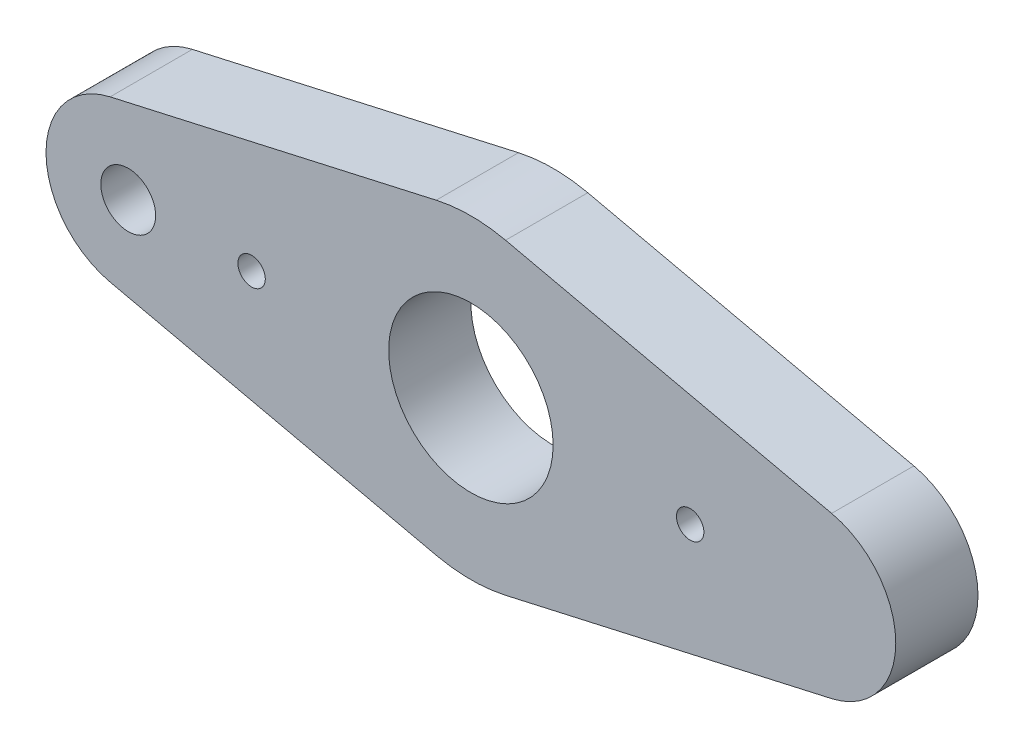
from build123d import *

# Parameters (mm, degrees)
CROQUIS1_R              = 2
CROQUIS1_R_2            = 6
CROQUIS1_R_3            = 1
SALIENTE_EXTRUIR1_DEPTH = 6


with BuildPart() as part:
    # Croquis1 → Saliente-Extruir1 (new body)
    with BuildSketch(Plane.XY):
        with BuildLine():
            Line((-26.32, 5.852999231), (-2.53, 11.218248526))
            ThreePointArc((-2.53, 11.218248526), (0, 11.5), (2.53, 11.218248526))
            Line((2.53, 11.218248526), (26.32, 5.852999231))
            ThreePointArc((26.32, 5.852999231), (31, 0), (26.32, -5.852999231))
            Line((26.32, -5.852999231), (2.53, -11.218248526))
            ThreePointArc((2.53, -11.218248526), (0, -11.5), (-2.53, -11.218248526))
            Line((-2.53, -11.218248526), (-26.32, -5.852999231))
            ThreePointArc((-26.32, -5.852999231), (-31, 0), (-26.32, 5.852999231))
        make_face()
        with Locations((-25, 0)):
            Circle(CROQUIS1_R, mode=Mode.SUBTRACT)
        Circle(CROQUIS1_R_2, mode=Mode.SUBTRACT)
        with Locations((-16, 0)):
            Circle(CROQUIS1_R_3, mode=Mode.SUBTRACT)
        with Locations(Location((16, 0, 0), (0, 0, 180))):
            Circle(CROQUIS1_R_3, mode=Mode.SUBTRACT)
    extrude(amount=SALIENTE_EXTRUIR1_DEPTH)


solid = part.part
